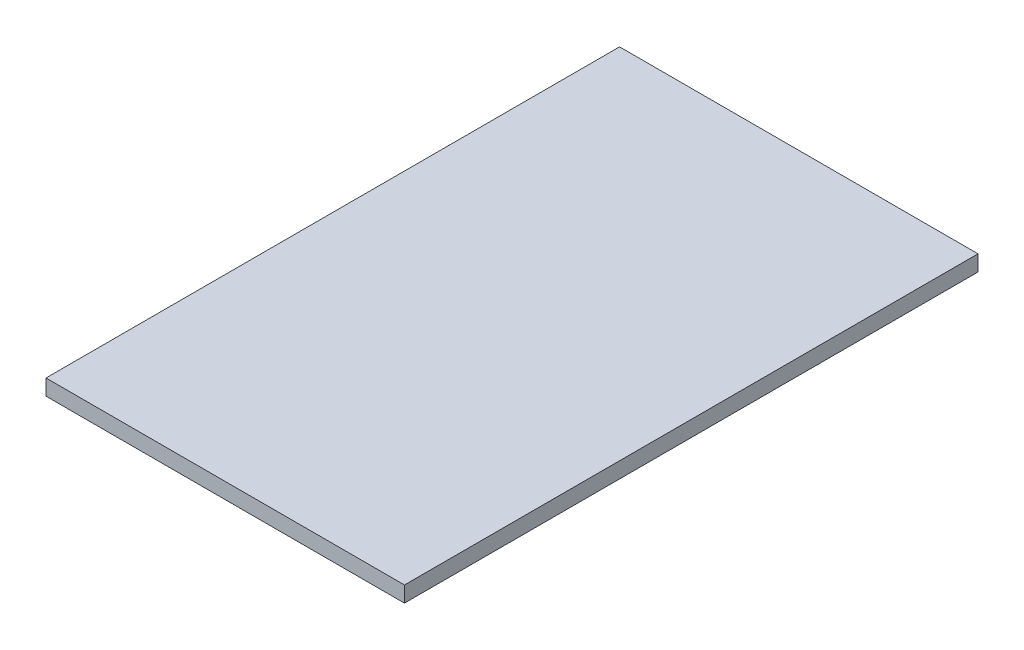
from build123d import *

# Parameters (mm, degrees)
SKETCH1_W           = 50
SKETCH1_H           = 80
BOSS_EXTRUDE1_DEPTH = 1.1


with BuildPart() as part:
    # Sketch1 → Boss-Extrude1 (new, symmetric)
    with BuildSketch(Plane(origin=(0, 0, 0), x_dir=(1, 0, 0), z_dir=(0, 1, 0))):
        Rectangle(SKETCH1_W, SKETCH1_H)
    extrude(amount=BOSS_EXTRUDE1_DEPTH, both=True)


solid = part.part
